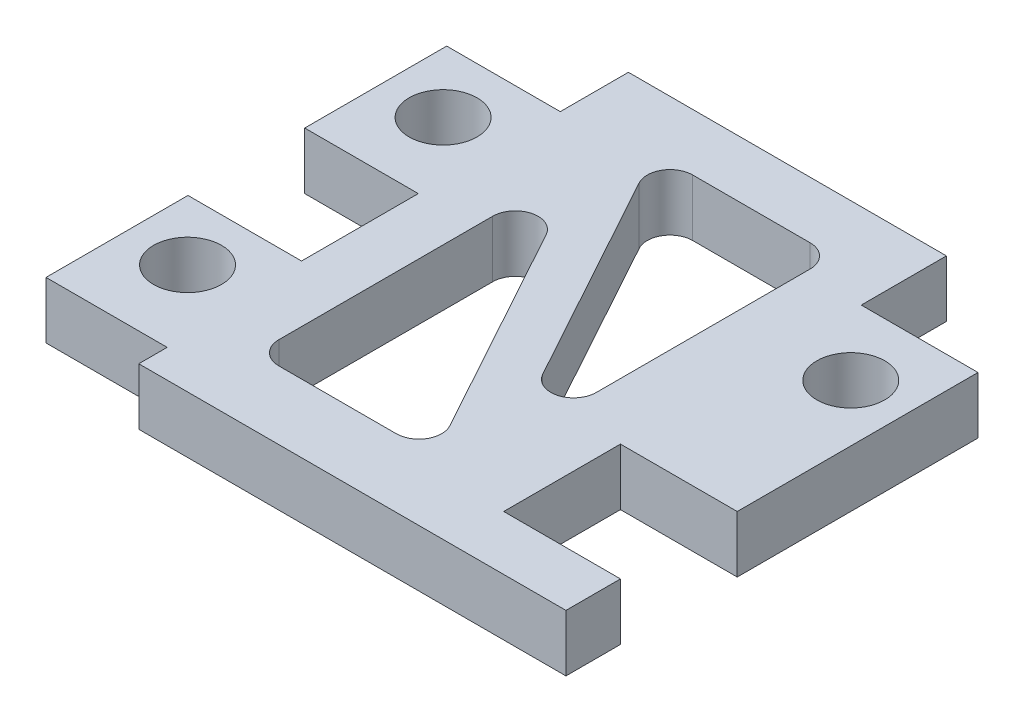
from build123d import *

# Parameters (mm, degrees)
BOSS_EXTRUDE1_DEPTH       = 3.175
F_6_CLEARANCE_HOLE1_D     = 3.7973
F_6_CLEARANCE_HOLE1_DEPTH = 6.35
F_6_CLEARANCE_HOLE1_TIP   = 1.140824014
FILLET1_R                 = 1.27


with BuildPart() as part:
    # Sketch1 → Boss-Extrude1 (new body)
    with BuildSketch(Plane(origin=(0, 0, 0), x_dir=(1, 0, 0), z_dir=(0, 1, 0))):
        Polygon((-9.403419359, 20.244676918), (-9.403419359, 13.716876918), (-15.753419359, 13.716876918), (-15.753419359, 5.779376918), (-8.9789, 5.779376918), (-8.9789, 4.191876918), (14.904380641, 4.191876918), (14.904380641, 7.239876918), (8.376580641, 7.239876918), (8.376580641, 13.767676918), (14.904380641, 13.767676918), (14.904380641, 27.229676918), (8.376580641, 27.229676918), (8.376580641, 31.992176918), (-9.403419359, 31.992176918), (-9.403419359, 28.182176918), (-15.753419359, 28.182176918), (-15.753419359, 20.244676918), align=None)
        Polygon((-6.228419359, 8.001876918), (-6.228419359, 26.178617608), (3.752707316, 8.001876918), align=None, mode=Mode.SUBTRACT)
        Polygon((5.201580641, 28.817176918), (5.201580641, 10.640436229), (-4.779546034, 28.817176918), align=None, mode=Mode.SUBTRACT)
    extrude(amount=BOSS_EXTRUDE1_DEPTH)

    # #6 Clearance Hole1
    with Locations(Plane(origin=(11.855385862, 0, -6.482820987), x_dir=(-1, 0, 0), z_dir=(0, -1, 0))):
        with Locations((0.126005221, 16.809855931), (24.256005221, 18.145395592), (24.256005221, 3.857895592)):
            Hole(F_6_CLEARANCE_HOLE1_D / 2, depth=F_6_CLEARANCE_HOLE1_DEPTH)
            with Locations((0, 0, -(F_6_CLEARANCE_HOLE1_DEPTH + F_6_CLEARANCE_HOLE1_TIP / 2))):  # 118° drill point
                Cone(0, F_6_CLEARANCE_HOLE1_D / 2, F_6_CLEARANCE_HOLE1_TIP, mode=Mode.SUBTRACT)

    # Fillet1
    fillet1_edges = [part.edges().sort_by_distance(p)[0] for p in [
        (3.752707316, 1.5875, -8.001876918),
        (-6.228419359, 1.5875, -26.178617608),
        (-6.228419359, 1.5875, -8.001876918),
        (5.201580641, 1.5875, -10.640436229),
        (5.201580641, 1.5875, -28.817176918),
        (-4.779546034, 1.5875, -28.817176918),
    ]]
    fillet(fillet1_edges, radius=FILLET1_R)


solid = part.part
